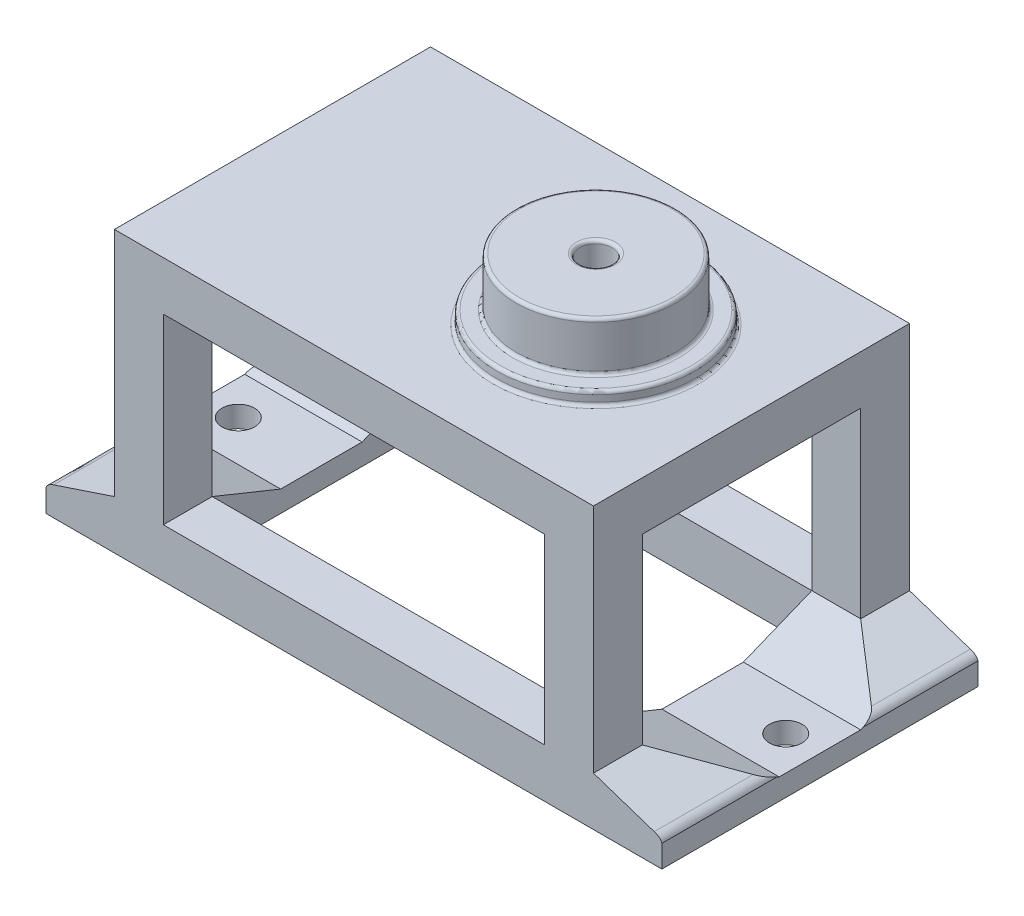
from build123d import *

# Parameters (mm, degrees)
SKETCH_1_W          = 29.4
SKETCH_1_H          = 19.4
SKETCH_1_W_2        = 23.4
SKETCH_1_H_2        = 13.4
EXTRUDE_1_DEPTH     = 16.4
SKETCH_2_W          = 29.4
SKETCH_2_H          = 19.4
EXTRUDE_2_DEPTH     = 0.8
SKETCH_3_R          = 6.1
EXTRUDE_3_DEPTH     = 0.8
SKETCH_5_R          = 4.9
SKETCH_5_R_2        = 1
EXTRUDE_4_DEPTH     = 3
FILLET_1_R          = 0.2
SKETCH_7_W          = 13.4
SKETCH_7_H          = 5.6
CUT_EXTRUDE_2_DEPTH = 30
SKETCH_8_W          = 23.4
SKETCH_8_H          = 5.6
CUT_EXTRUDE_3_DEPTH = 30
SKETCH_9_W          = 19.4
SKETCH_9_H          = 3
EXTRUDE_5_DEPTH     = 4.2
CUT_EXTRUDE_4_DEPTH = 20.2
CUT_EXTRUDE_5_DEPTH = 5.1
SKETCH_12_R         = 1
CUT_EXTRUDE_6_DEPTH = 2.2


with BuildPart() as part:
    # 草图1 → 凸台-拉伸1 (new body)
    with BuildSketch(Plane(origin=(0, 0, 0), x_dir=(1, 0, 0), z_dir=(0, 1, 0))):
        Rectangle(SKETCH_1_W, SKETCH_1_H)
        Rectangle(SKETCH_1_W_2, SKETCH_1_H_2, mode=Mode.SUBTRACT)
    extrude(amount=EXTRUDE_1_DEPTH)

    # 草图2 → 凸台-拉伸2 (add)
    with BuildSketch(Plane(origin=(0, 16.4, 0), x_dir=(1, 0, 0), z_dir=(0, 1, 0))):
        Rectangle(SKETCH_2_W, SKETCH_2_H)
    extrude(amount=EXTRUDE_2_DEPTH)

    # 草图3 → 凸台-拉伸3 (add)
    with BuildSketch(Plane(origin=(0, 17.2, 0), x_dir=(1, 0, 0), z_dir=(0, 1, 0))):
        with Locations(Location((5.15, 0, 0), (0, 0, 270))):
            Circle(SKETCH_3_R)
    extrude(amount=EXTRUDE_3_DEPTH)

    # 草图5 → 凸台-拉伸4 (add)
    with BuildSketch(Plane(origin=(0, 18, 0), x_dir=(1, 0, 0), z_dir=(0, 1, 0))):
        with Locations(Location((5.15, 0, 0), (0, 0, 270))):
            Circle(SKETCH_5_R)
        with Locations(Location((5.15, 0, 0), (0, 0, 270))):
            Circle(SKETCH_5_R_2, mode=Mode.SUBTRACT)
    extrude(amount=EXTRUDE_4_DEPTH)

    # 圆角1
    fillet_1_edges = [part.edges().sort_by_distance(p)[0] for p in [
        (5.15, 17.2, -6.1),
        (5.15, 18, -6.1),
        (5.15, 18, -1),
        (5.15, 21, -4.9),
        (5.15, 18, -4.9),
        (5.15, 21, -1),
    ]]
    fillet(fillet_1_edges, radius=FILLET_1_R)

    # 草图7 → 切除-拉伸2 (cut)
    with BuildSketch(Plane.ZY.offset(14.7)):
        with Locations((0, 11.4)):
            Rectangle(SKETCH_7_W, SKETCH_7_H)
        with Locations((0, 5.8)):
            Rectangle(SKETCH_7_W, SKETCH_7_H)
    extrude(amount=-CUT_EXTRUDE_2_DEPTH, mode=Mode.SUBTRACT)

    # 草图8 → 切除-拉伸3 (cut)
    with BuildSketch(Plane(origin=(0, 0, -9.7), x_dir=(-1, 0, 0), z_dir=(0, 0, -1))):
        with Locations((0, 11.4)):
            Rectangle(SKETCH_8_W, SKETCH_8_H)
        with Locations((0, 5.8)):
            Rectangle(SKETCH_8_W, SKETCH_8_H)
    extrude(amount=-CUT_EXTRUDE_3_DEPTH, mode=Mode.SUBTRACT)

    # 草图9 → 凸台-拉伸5 (add)
    with BuildSketch(Plane(origin=(14.7, 0, 0), x_dir=(0, 0, -1), z_dir=(1, 0, 0))):
        with Locations((0, 1.5)):
            Rectangle(SKETCH_9_W, SKETCH_9_H)
    extrude_5 = extrude(amount=EXTRUDE_5_DEPTH)

    # 草图10 → 切除-拉伸4 (cut)
    with BuildSketch(Plane.XY.offset(9.7)):
        with BuildLine():
            add(Edge.make_bspline(
                [(18.486644801, 1.737785066), (18.825886074, 1.616028978), (18.9, 1.36920832)],
                knots=[0.049557912, 0.049557912, 0.049557912, 0.659174515, 0.659174515, 0.659174515], degree=2))
            Line((18.9, 1.36920832), (18.9, 1.6))
            Line((18.9, 1.6), (18.9, 3))
            Line((18.9, 3), (14.7, 3))
            Line((14.7, 3), (18.429736397, 1.756754534))
            add(Edge.make_bspline(
                [(18.429736397, 1.756754534), (18.459066665, 1.747683054), (18.486644801, 1.737785066)],
                knots=[0, 0, 0, 0.049557912, 0.049557912, 0.049557912], degree=2))
        make_face()
    cut_extrude_4 = extrude(amount=-CUT_EXTRUDE_4_DEPTH, mode=Mode.SUBTRACT)

    # 草图11 → 切除-拉伸5 (cut, symmetric)
    with BuildSketch(Plane(origin=(14.7, 0, 0), x_dir=(0, 0, -1), z_dir=(1, 0, 0))):
        Polygon((2.5, 1.3), (6.7, 3), (-6.7, 3), (-2.5, 1.3), align=None)
    cut_extrude_5 = extrude(amount=CUT_EXTRUDE_5_DEPTH, both=True, mode=Mode.SUBTRACT)

    # 草图12 → 切除-拉伸6 (cut)
    with BuildSketch(Plane(origin=(0, 1.3, 0), x_dir=(1, 0, 0), z_dir=(0, 1, 0))):
        with Locations(Location((16.8, 0, 0), (0, 0, 270))):
            Circle(SKETCH_12_R)
    cut_extrude_6 = extrude(amount=-CUT_EXTRUDE_6_DEPTH, mode=Mode.SUBTRACT)

    # 镜向1: 凸台-拉伸5, 切除-拉伸4, 切除-拉伸5, 切除-拉伸6 across plane
    add(extrude_5.mirror(Plane(origin=(0, 0, 0), x_dir=(0, 0, 1), z_dir=(1, 0, 0))))
    add(cut_extrude_4.mirror(Plane(origin=(0, 0, 0), x_dir=(0, 0, 1), z_dir=(1, 0, 0))), mode=Mode.SUBTRACT)
    add(cut_extrude_5.mirror(Plane(origin=(0, 0, 0), x_dir=(0, 0, 1), z_dir=(1, 0, 0))), mode=Mode.SUBTRACT)
    add(cut_extrude_6.mirror(Plane(origin=(0, 0, 0), x_dir=(0, 0, 1), z_dir=(1, 0, 0))), mode=Mode.SUBTRACT)


solid = part.part
